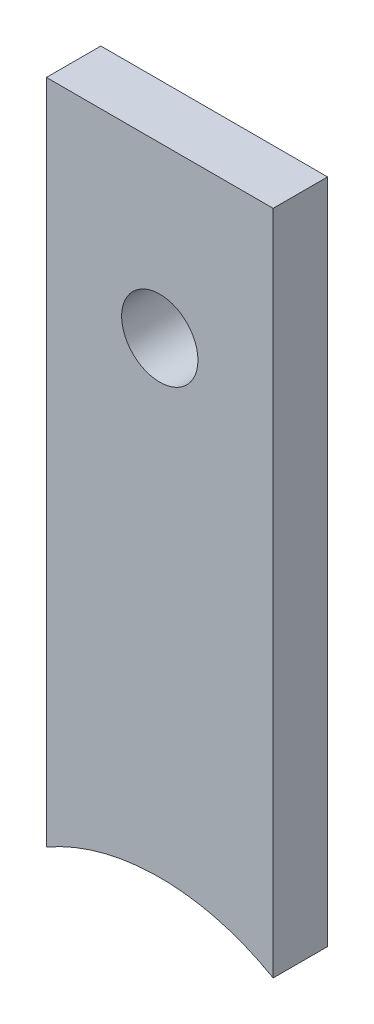
from build123d import *

# Parameters (mm, degrees)
SKETCH1_R           = 8.412952976
BOSS_EXTRUDE1_DEPTH = 12


with BuildPart() as part:
    # Sketch1 → Boss-Extrude1 (new body)
    with BuildSketch(Plane.XY):
        with BuildLine():
            Line((-25, -73.5), (-25, 73.5))
            Line((-25, 73.5), (25, 73.5))
            Line((25, 73.5), (25, -73.5))
            ThreePointArc((25, -73.5), (0, -66.801270189), (-25, -73.5))
        make_face()
        with Locations((0, 36.198729811)):
            Circle(SKETCH1_R, mode=Mode.SUBTRACT)
    extrude(amount=BOSS_EXTRUDE1_DEPTH)


solid = part.part
